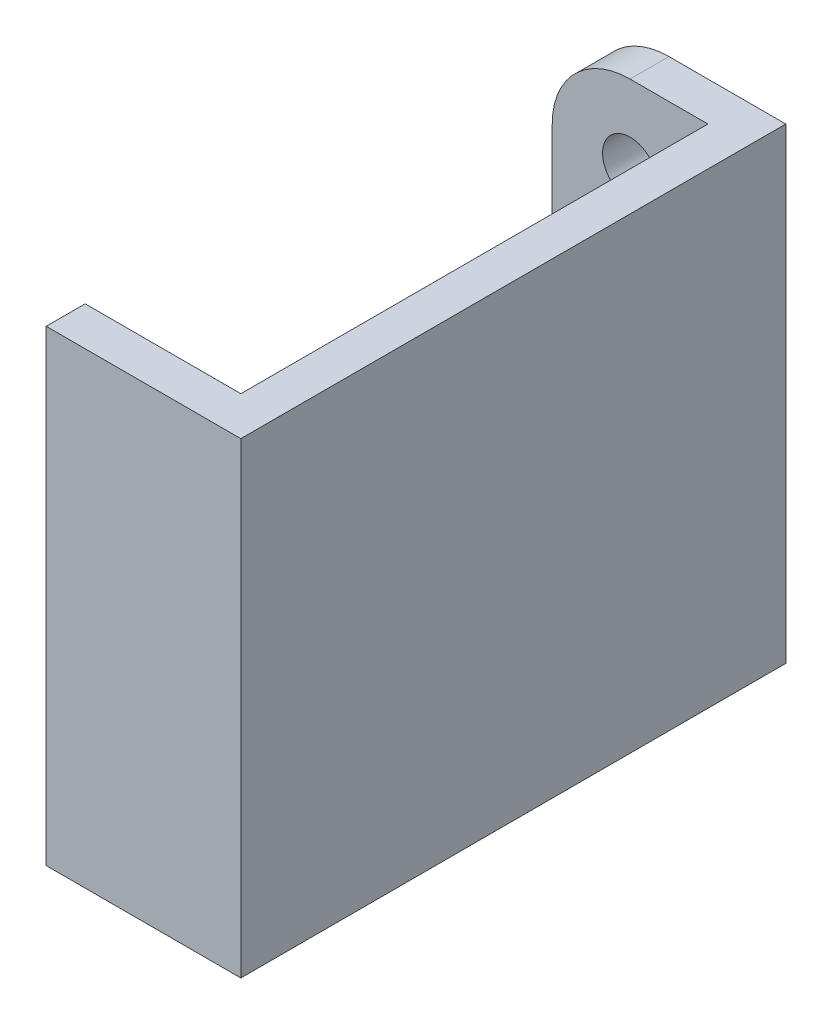
from build123d import *

# Parameters (mm, degrees)
SKETCH1_W           = 15.875
SKETCH1_H           = 38.1
BOSS_EXTRUDE1_DEPTH = 44.45
SHELL1_T            = -3.175
CUT_EXTRUDE1_REACH  = 48.147
SKETCH2_R           = 2.2479
FILLET2_R           = 6.35


with BuildPart() as part:
    # Sketch1 → Boss-Extrude1 (new body)
    with BuildSketch(Plane.XY):
        Rectangle(SKETCH1_W, SKETCH1_H)
    extrude(amount=-BOSS_EXTRUDE1_DEPTH)

    # Shell1
    shell1_openings = [part.faces().sort_by_distance(p)[0] for p in [
        (-7.9375, 0, -22.225),
        (0, 19.05, -22.225),
    ]]
    offset(amount=SHELL1_T, openings=shell1_openings, kind=Kind.INTERSECTION)

    # Sketch2 → Cut-Extrude1 (cut, up to next)
    with BuildSketch(Plane.XY.offset(-3.175), mode=Mode.PRIVATE) as cut_extrude1_sk1:
        with Locations((-1.5875, -6.35)):
            Circle(SKETCH2_R)
    cut_extrude1_tool1 = extrude(cut_extrude1_sk1.sketch, amount=-CUT_EXTRUDE1_REACH, mode=Mode.PRIVATE) & part.part
    # Sketch2 → Cut-Extrude1 (cut, up to next)
    with BuildSketch(Plane.XY.offset(-3.175), mode=Mode.PRIVATE) as cut_extrude1_sk2:
        with Locations((-1.5875, 12.7)):
            Circle(SKETCH2_R)
    cut_extrude1_tool2 = extrude(cut_extrude1_sk2.sketch, amount=-CUT_EXTRUDE1_REACH, mode=Mode.PRIVATE) & part.part
    add(cut_extrude1_tool1.solids().sort_by_distance((-1.5875, -6.35, -3.175))[0], mode=Mode.SUBTRACT)
    add(cut_extrude1_tool2.solids().sort_by_distance((-1.5875, 12.7, -3.175))[0], mode=Mode.SUBTRACT)

    # Fillet2
    fillet2_edges = [part.edges().sort_by_distance(p)[0] for p in [
        (-7.9375, 19.05, -42.8625),
    ]]
    fillet(fillet2_edges, radius=FILLET2_R)


solid = part.part
